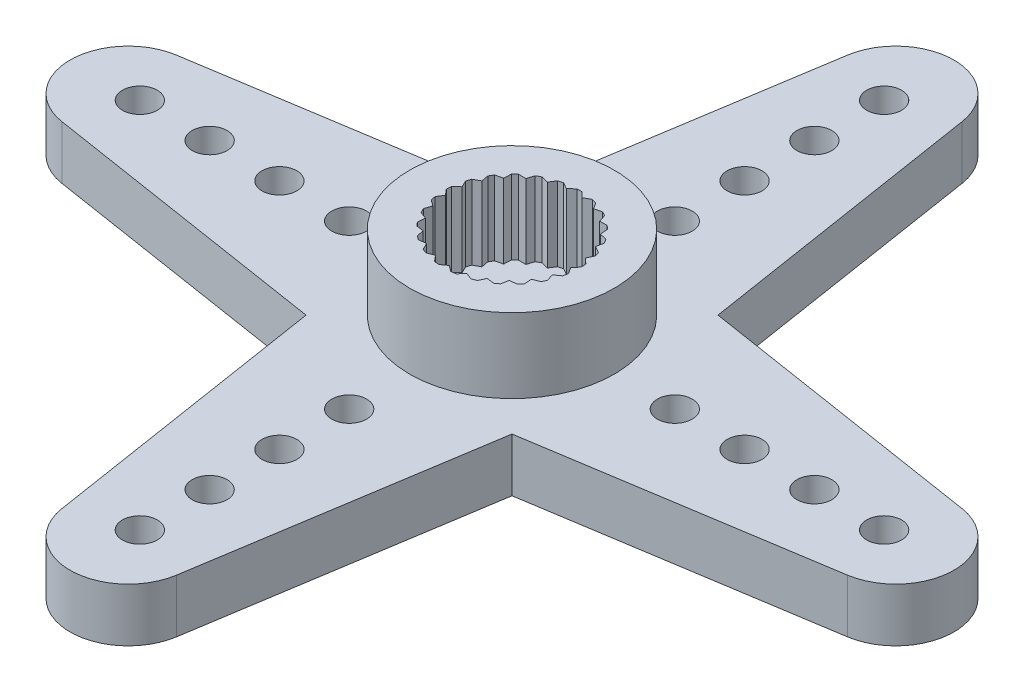
from build123d import *

# Parameters (mm, degrees)
SKETCH2_R           = 6
SKETCH2_R_2         = 1.5
BOSS_EXTRUDE1_DEPTH = 1.15
SKETCH3_R           = 4.4
BOSS_EXTRUDE2_DEPTH = 3.2
SKETCH4_R           = 0.75
BOSS_EXTRUDE3_DEPTH = 1.15
CIRPATTERN1_COUNT   = 4


with BuildPart() as part:
    # Sketch2 → Boss-Extrude1 (new, symmetric)
    with BuildSketch(Plane(origin=(0, 0, 0), x_dir=(1, 0, 0), z_dir=(0, 1, 0))):
        with Locations(Location((0, 0, 0), (0, 0, 270))):
            Circle(SKETCH2_R)
        with Locations(Location((0, 0, 0), (0, 0, 270))):
            Circle(SKETCH2_R_2, mode=Mode.SUBTRACT)
    extrude(amount=BOSS_EXTRUDE1_DEPTH, both=True)

    # Sketch3 → Boss-Extrude2 (add)
    with BuildSketch(Plane(origin=(0, 1.15, 0), x_dir=(1, 0, 0), z_dir=(0, 1, 0))):
        with Locations(Location((0, 0, 0), (0, 0, 270))):
            Circle(SKETCH3_R)
        with BuildLine():
            Line((0.107421435, 2.898009771), (0.338399731, 2.678709694))
            Line((0.338399731, 2.678709694), (0.61665913, 2.83367809))
            ThreePointArc((0.61665913, 2.83367809), (0.721200673, 2.808891167), (0.824752316, 2.780248841))
            Line((0.824752316, 2.780248841), (0.993936292, 2.510396512))
            Line((0.993936292, 2.510396512), (1.301992734, 2.591295993))
            ThreePointArc((1.301992734, 2.591295993), (1.397085655, 2.541289372), (1.490260976, 2.48779465))
            Line((1.490260976, 2.48779465), (1.587020181, 2.184345885))
            Line((1.587020181, 2.184345885), (1.905517346, 2.186093238))
            ThreePointArc((1.905517346, 2.186093238), (1.985186607, 2.11400902), (2.062131058, 2.039023173))
            Line((2.062131058, 2.039023173), (2.080385755, 1.721044772))
            Line((2.080385755, 1.721044772), (2.389311295, 1.643530205))
            ThreePointArc((2.389311295, 1.643530205), (2.448550984, 1.553897705), (2.504429862, 1.46213237))
            Line((2.504429862, 1.46213237), (2.443033042, 1.149604087))
            Line((2.443033042, 1.149604087), (2.722976028, 0.997698125))
            ThreePointArc((2.722976028, 0.997698125), (2.758063897, 0.896149284), (2.789366126, 0.793370413))
            Line((2.789366126, 0.793370413), (2.652175577, 0.505929549))
            Line((2.652175577, 0.505929549), (2.885546163, 0.289177003))
            ThreePointArc((2.885546163, 0.289177003), (2.894277512, 0.182092507), (2.899036259, 0.074758075))
            Line((2.899036259, 0.074758075), (2.694672167, -0.169534403))
            Line((2.694672167, -0.169534403), (2.866806821, -0.437514174))
            ThreePointArc((2.866806821, -0.437514174), (2.848633027, -0.543405812), (2.826549281, -0.648551587))
            Line((2.826549281, -0.648551587), (2.567852594, -0.834345885))
            Line((2.567852594, -0.834345885), (2.667935462, -1.136714727))
            ThreePointArc((2.667935462, -1.136714727), (2.623998452, -1.234759946), (2.576459817, -1.331110368))
            Line((2.576459817, -1.331110368), (2.279685399, -1.446732346))
            Line((2.279685399, -1.446732346), (2.301427906, -1.764491312))
            ThreePointArc((2.301427906, -1.764491312), (2.234488404, -1.84852957), (2.164481907, -1.930030589))
            Line((2.164481907, -1.930030589), (1.848277186, -1.968215294))
            Line((1.848277186, -1.968215294), (1.790313171, -2.281398419))
            ThreePointArc((1.790313171, -2.281398419), (1.704577232, -2.346149284), (1.616501638, -2.40767989))
            Line((1.616501638, -2.40767989), (1.30073492, -2.366028036))
            Line((1.30073492, -2.366028036), (1.166706475, -2.654956874))
            ThreePointArc((1.166706475, -2.654956874), (1.067561203, -2.696351809), (0.966950626, -2.734045809))
            Line((0.966950626, -2.734045809), (0.671462695, -2.615174535))
            Line((0.671462695, -2.615174535), (0.469791321, -2.861694623))
            ThreePointArc((0.469791321, -2.861694623), (0.363466377, -2.877132634), (0.25664255, -2.888621575))
            Line((0.25664255, -2.888621575), (0, -2.7))
            Line((0, -2.7), (-0.25664255, -2.888621575))
            ThreePointArc((-0.25664255, -2.888621575), (-0.363466377, -2.877132634), (-0.469791321, -2.861694623))
            Line((-0.469791321, -2.861694623), (-0.671462695, -2.615174535))
            Line((-0.671462695, -2.615174535), (-0.966950626, -2.734045809))
            ThreePointArc((-0.966950626, -2.734045809), (-1.067561203, -2.696351809), (-1.166706475, -2.654956874))
            Line((-1.166706475, -2.654956874), (-1.30073492, -2.366028036))
            Line((-1.30073492, -2.366028036), (-1.616501638, -2.40767989))
            ThreePointArc((-1.616501638, -2.40767989), (-1.704577232, -2.346149284), (-1.790313171, -2.281398419))
            Line((-1.790313171, -2.281398419), (-1.848277186, -1.968215294))
            Line((-1.848277186, -1.968215294), (-2.164481907, -1.930030589))
            ThreePointArc((-2.164481907, -1.930030589), (-2.234488404, -1.84852957), (-2.301427906, -1.764491312))
            Line((-2.301427906, -1.764491312), (-2.279685399, -1.446732346))
            Line((-2.279685399, -1.446732346), (-2.576459817, -1.331110368))
            ThreePointArc((-2.576459817, -1.331110368), (-2.623998452, -1.234759946), (-2.667935462, -1.136714727))
            Line((-2.667935462, -1.136714727), (-2.567852594, -0.834345885))
            Line((-2.567852594, -0.834345885), (-2.826549281, -0.648551587))
            ThreePointArc((-2.826549281, -0.648551587), (-2.848633027, -0.543405812), (-2.866806821, -0.437514174))
            Line((-2.866806821, -0.437514174), (-2.694672167, -0.169534403))
            Line((-2.694672167, -0.169534403), (-2.899036259, 0.074758075))
            ThreePointArc((-2.899036259, 0.074758075), (-2.894277512, 0.182092507), (-2.885546163, 0.289177003))
            Line((-2.885546163, 0.289177003), (-2.652175577, 0.505929549))
            Line((-2.652175577, 0.505929549), (-2.789366126, 0.793370413))
            ThreePointArc((-2.789366126, 0.793370413), (-2.758063897, 0.896149284), (-2.722976028, 0.997698125))
            Line((-2.722976028, 0.997698125), (-2.443033042, 1.149604087))
            Line((-2.443033042, 1.149604087), (-2.504429862, 1.46213237))
            ThreePointArc((-2.504429862, 1.46213237), (-2.448550984, 1.553897705), (-2.389311295, 1.643530205))
            Line((-2.389311295, 1.643530205), (-2.080385755, 1.721044772))
            Line((-2.080385755, 1.721044772), (-2.062131058, 2.039023173))
            ThreePointArc((-2.062131058, 2.039023173), (-1.985186607, 2.11400902), (-1.905517346, 2.186093238))
            Line((-1.905517346, 2.186093238), (-1.587020181, 2.184345885))
            Line((-1.587020181, 2.184345885), (-1.490260976, 2.48779465))
            ThreePointArc((-1.490260976, 2.48779465), (-1.397085655, 2.541289372), (-1.301992734, 2.591295993))
            Line((-1.301992734, 2.591295993), (-0.993936292, 2.510396512))
            Line((-0.993936292, 2.510396512), (-0.824752316, 2.780248841))
            ThreePointArc((-0.824752316, 2.780248841), (-0.721200673, 2.808891167), (-0.61665913, 2.83367809))
            Line((-0.61665913, 2.83367809), (-0.338399731, 2.678709694))
            Line((-0.338399731, 2.678709694), (-0.107421435, 2.898009771))
            ThreePointArc((-0.107421435, 2.898009771), (0, 2.9), (0.107421435, 2.898009771))
        make_face(mode=Mode.SUBTRACT)
    extrude(amount=BOSS_EXTRUDE2_DEPTH)

    # Sketch4 → Boss-Extrude3 (add, symmetric)
    with BuildSketch(Plane(origin=(0, 0, 0), x_dir=(1, 0, 0), z_dir=(0, 1, 0))):
        with BuildLine():
            Line((3.968626967, 4.5), (16.888114198, 2.469689731))
            ThreePointArc((16.888114198, 2.469689731), (19, 0), (16.888114198, -2.469689731))
            Line((16.888114198, -2.469689731), (3.968626967, -4.5))
            ThreePointArc((3.968626967, -4.5), (6, 0), (3.968626967, 4.5))
        make_face()
        with Locations(Location((16, 0, 0), (0, 0, 270))):
            Circle(SKETCH4_R, mode=Mode.SUBTRACT)
        with Locations(Location((13, 0, 0), (0, 0, 270))):
            Circle(SKETCH4_R, mode=Mode.SUBTRACT)
        with Locations(Location((10, 0, 0), (0, 0, 270))):
            Circle(SKETCH4_R, mode=Mode.SUBTRACT)
        with Locations(Location((7, 0, 0), (0, 0, 270))):
            Circle(SKETCH4_R, mode=Mode.SUBTRACT)
    boss_extrude3 = extrude(amount=BOSS_EXTRUDE3_DEPTH, both=True)

    # CirPattern1: Boss-Extrude3 ×4 about axis
    cirpattern1_axis = Axis((0, 0, 0), (0, 1, 0))
    for i in range(1, CIRPATTERN1_COUNT):
        add(boss_extrude3.rotate(cirpattern1_axis, i * 360 / CIRPATTERN1_COUNT))


solid = part.part
